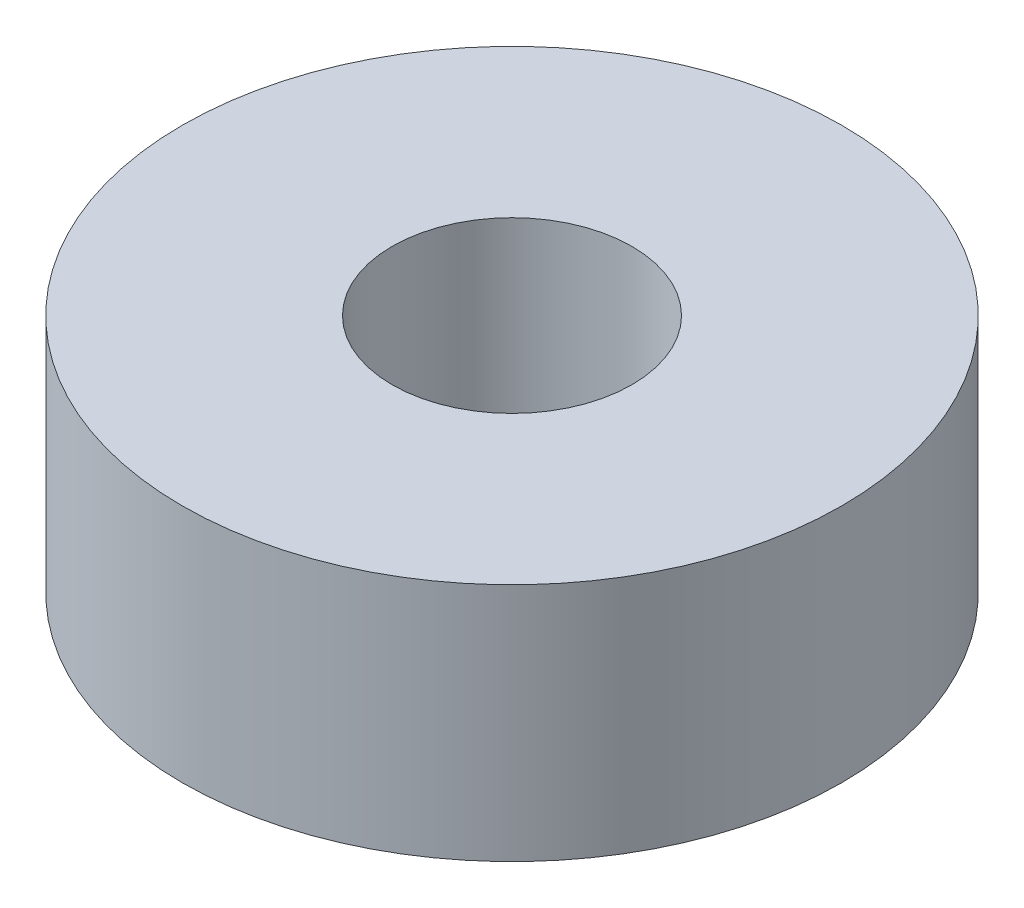
from build123d import *

# Parameters (mm, degrees)
SKETCH_1_R      = 5.5
SKETCH_1_R_2    = 2
EXTRUDE_1_DEPTH = 4


with BuildPart() as part:
    # Эскиз1 → Вытянуть1 (new body)
    with BuildSketch(Plane(origin=(0, 0, 0), x_dir=(1, 0, 0), z_dir=(0, 1, 0))):
        with Locations(Location((0, 0, 0), (0, 0, 270))):
            Circle(SKETCH_1_R)
        with Locations(Location((0, 0, 0), (0, 0, 270))):
            Circle(SKETCH_1_R_2, mode=Mode.SUBTRACT)
    extrude(amount=EXTRUDE_1_DEPTH)


solid = part.part
